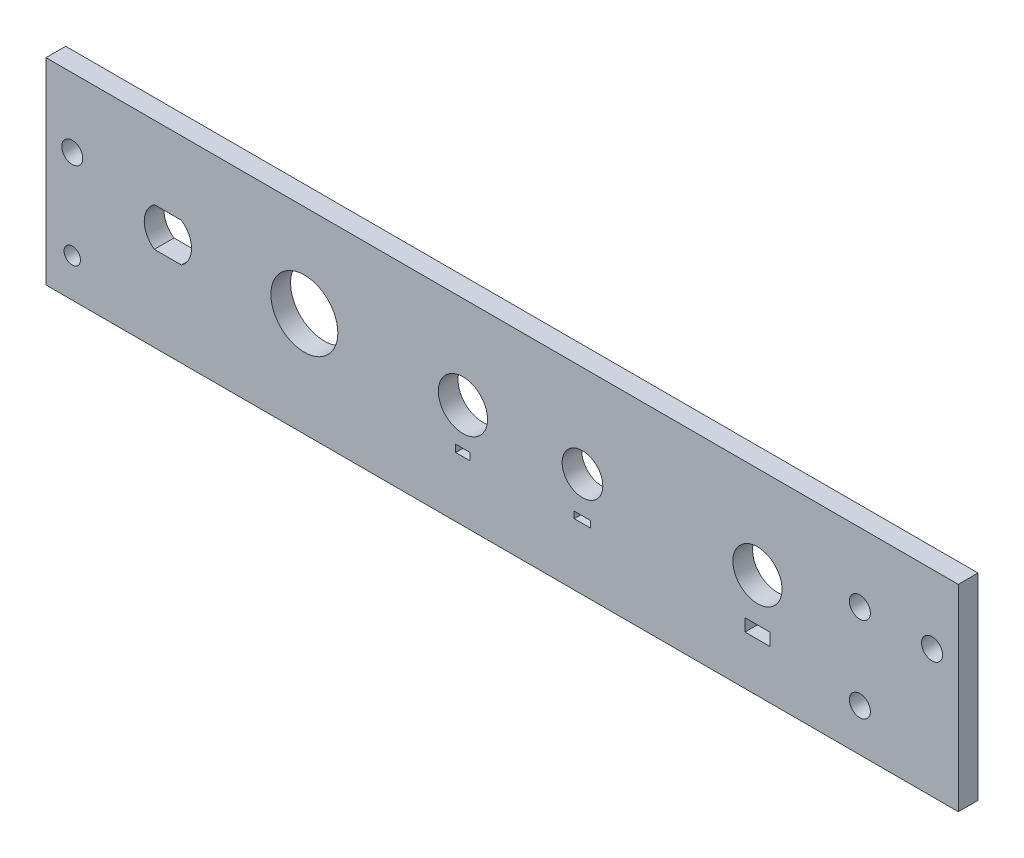
from build123d import *

# Parameters (mm, degrees)
SKETCH1_W           = 139
SKETCH1_H           = 30
SKETCH1_R           = 1.6
SKETCH1_R_2         = 5.1
SKETCH1_R_3         = 3.75
SKETCH1_R_4         = 3.1
SKETCH1_R_5         = 1.25
SKETCH1_W_2         = 2.2
SKETCH1_H_2         = 1.1
SKETCH1_W_3         = 2.5
SKETCH1_H_3         = 1
SKETCH1_W_4         = 3.8
SKETCH1_H_4         = 1.9
BOSS_EXTRUDE1_DEPTH = 3


with BuildPart() as part:
    # Sketch1 → Boss-Extrude1 (new body)
    with BuildSketch(Plane.XY):
        with Locations((69.5, 15)):
            Rectangle(SKETCH1_W, SKETCH1_H)
        with Locations((4, 19.5)):
            Circle(SKETCH1_R, mode=Mode.SUBTRACT)
        with Locations((135, 19.5)):
            Circle(SKETCH1_R, mode=Mode.SUBTRACT)
        with Locations((124, 19.5)):
            Circle(SKETCH1_R, mode=Mode.SUBTRACT)
        with Locations((39.361239448, 15.906458033)):
            Circle(SKETCH1_R_2, mode=Mode.SUBTRACT)
        with Locations((63.522500572, 15.906458033)):
            Circle(SKETCH1_R_3, mode=Mode.SUBTRACT)
        with Locations((81.730883445, 15.906458033)):
            Circle(SKETCH1_R_4, mode=Mode.SUBTRACT)
        with Locations((108.399727047, 15.906458033)):
            Circle(SKETCH1_R_3, mode=Mode.SUBTRACT)
        with Locations((4, 5.895808563)):
            Circle(SKETCH1_R_5, mode=Mode.SUBTRACT)
        with Locations((124, 6.5)):
            Circle(SKETCH1_R, mode=Mode.SUBTRACT)
        with Locations((63.522500572, 9.656458033)):
            Rectangle(SKETCH1_W_2, SKETCH1_H_2, mode=Mode.SUBTRACT)
        with Locations((81.730883445, 9.906458033)):
            Rectangle(SKETCH1_W_3, SKETCH1_H_3, mode=Mode.SUBTRACT)
        with Locations((108.399727047, 8.406458033)):
            Rectangle(SKETCH1_W_4, SKETCH1_H_4, mode=Mode.SUBTRACT)
        with BuildLine():
            Line((16.505280772, 12.956458033), (20.632022828, 12.956458033))
            ThreePointArc((20.632022828, 12.956458033), (22.1686518, 15.906458033), (20.632022828, 18.856458033))
            Line((20.632022828, 18.856458033), (16.505280772, 18.856458033))
            ThreePointArc((16.505280772, 18.856458033), (14.9686518, 15.906458033), (16.505280772, 12.956458033))
        make_face(mode=Mode.SUBTRACT)
    extrude(amount=BOSS_EXTRUDE1_DEPTH)


solid = part.part
